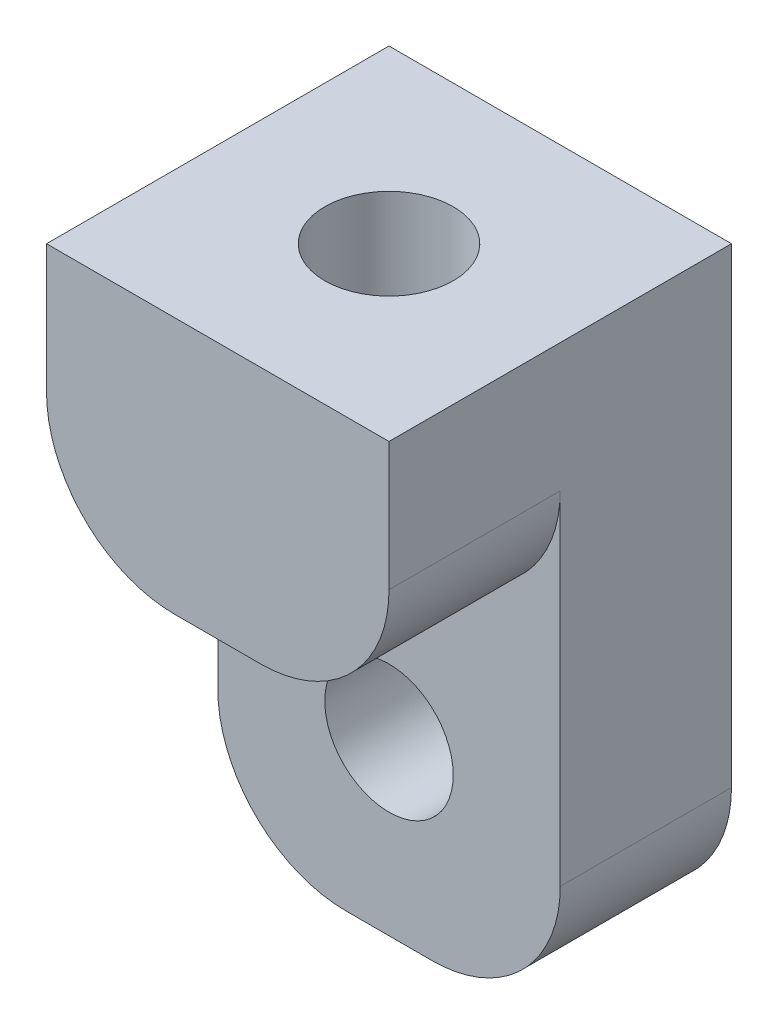
from build123d import *

# Parameters (mm, degrees)
SKETCH1_W           = 40
SKETCH1_H           = 70
SKETCH1_R           = 7.5
BOSS_EXTRUDE1_DEPTH = 40
CUT_EXTRUDE1_DEPTH  = 20
SKETCH3_W           = 40
SKETCH3_H           = 40
CUT_EXTRUDE2_DEPTH  = 20
FILLET1_R           = 15


with BuildPart() as part:
    # Sketch1 → Boss-Extrude1 (new body)
    with BuildSketch(Plane.XY):
        with Locations((0, 15)):
            Rectangle(SKETCH1_W, SKETCH1_H)
        Circle(SKETCH1_R, mode=Mode.SUBTRACT)
    extrude(amount=BOSS_EXTRUDE1_DEPTH)

    # Sketch2 → Cut-Extrude1 (cut)
    with BuildSketch(Plane(origin=(0, 50, 0), x_dir=(1, 0, 0), z_dir=(0, 1, 0))):
        with BuildLine():
            ThreePointArc((7.5, -20), (2.870125743, -13.070903506), (-5.303300859, -14.696699141))
            Line((-5.303300859, -14.696699141), (5.303300859, -25.303300859))
            ThreePointArc((5.303300859, -25.303300859), (6.929096494, -22.870125743), (7.5, -20))
        make_face()
        with BuildLine():
            Line((5.303300859, -25.303300859), (-5.303300859, -14.696699141))
            ThreePointArc((-5.303300859, -14.696699141), (-5.303300859, -25.303300859), (5.303300859, -25.303300859))
        make_face()
    extrude(amount=-CUT_EXTRUDE1_DEPTH, mode=Mode.SUBTRACT)

    # Sketch3 → Cut-Extrude2 (cut)
    with BuildSketch(Plane.XY.offset(40)):
        Rectangle(SKETCH3_W, SKETCH3_H)
    extrude(amount=-CUT_EXTRUDE2_DEPTH, mode=Mode.SUBTRACT)

    # Fillet1
    fillet1_edges = [part.edges().sort_by_distance(p)[0] for p in [
        (20, -20, 10),
        (-20, -20, 10),
        (-20, 20, 30),
        (20, 20, 30),
    ]]
    fillet(fillet1_edges, radius=FILLET1_R)


solid = part.part
